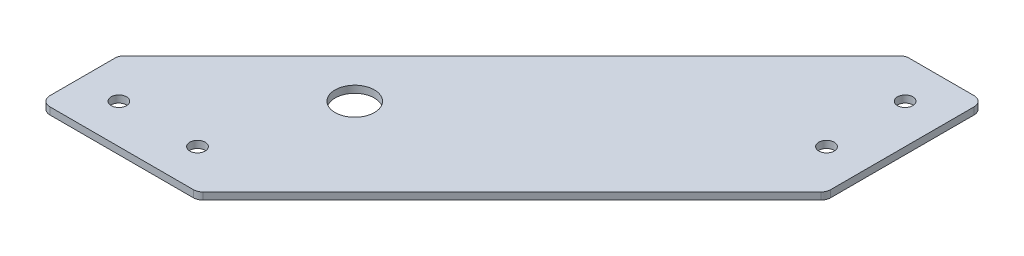
from build123d import *

# Parameters (mm, degrees)
SKETCH1_R           = 2.4892
SKETCH1_R_2         = 6.35
BOSS_EXTRUDE2_DEPTH = 1.143
CUT_EXTRUDE1_DEPTH  = 216.53826991
BOSS_EXTRUDE3_DEPTH = 2.286
FILLET3_R           = 3.175


with BuildPart() as part:
    # Sketch1 → Boss-Extrude2 (new, symmetric)
    with BuildSketch(Plane(origin=(0, 0, 0), x_dir=(1, 0, 0), z_dir=(0, 1, 0))):
        Polygon((0, 0), (0, 152.4), (-25.4, 152.4), (-152.4, 25.4), (-152.4, 0), align=None)
        with Locations(Location((-12.7, 12.7, 0), (0, 0, 270))):
            Circle(SKETCH1_R, mode=Mode.SUBTRACT)
        with Locations(Location((-38.1, 12.7, 0), (0, 0, 270))):
            Circle(SKETCH1_R, mode=Mode.SUBTRACT)
        with Locations(Location((-63.5, 12.7, 0), (0, 0, 270))):
            Circle(SKETCH1_R, mode=Mode.SUBTRACT)
        with Locations(Location((-88.9, 12.7, 0), (0, 0, 270))):
            Circle(SKETCH1_R, mode=Mode.SUBTRACT)
        with Locations(Location((-114.3, 12.7, 0), (0, 0, 270))):
            Circle(SKETCH1_R, mode=Mode.SUBTRACT)
        with Locations(Location((-12.7, 38.1, 0), (0, 0, 270))):
            Circle(SKETCH1_R, mode=Mode.SUBTRACT)
        with Locations(Location((-12.7, 63.5, 0), (0, 0, 270))):
            Circle(SKETCH1_R, mode=Mode.SUBTRACT)
        with Locations(Location((-12.7, 88.9, 0), (0, 0, 270))):
            Circle(SKETCH1_R, mode=Mode.SUBTRACT)
        with Locations(Location((-12.7, 114.3, 0), (0, 0, 270))):
            Circle(SKETCH1_R, mode=Mode.SUBTRACT)
        with Locations(Location((-139.7, 12.7, 0), (0, 0, 270))):
            Circle(SKETCH1_R, mode=Mode.SUBTRACT)
        with Locations(Location((-12.7, 139.7, 0), (0, 0, 270))):
            Circle(SKETCH1_R, mode=Mode.SUBTRACT)
        with Locations(Location((-101.6, 50.8, 0), (0, 0, 270))):
            Circle(SKETCH1_R_2, mode=Mode.SUBTRACT)
    extrude(amount=BOSS_EXTRUDE2_DEPTH, both=True)

    # Sketch2 → Cut-Extrude1 (cut, through all)
    with BuildSketch(Plane(origin=(0, 1.143, 0), x_dir=(1, 0, 0), z_dir=(0, 1, 0))):
        Polygon((0, 0), (0, 101.6), (-101.6, 0), align=None)
    extrude(amount=-CUT_EXTRUDE1_DEPTH, mode=Mode.SUBTRACT)

    # Sketch3 → Boss-Extrude3 (add)
    with BuildSketch(Plane(origin=(0, 1.143, 0), x_dir=(1, 0, 0), z_dir=(0, 1, 0))):
        Polygon((-101.6, 0), (-101.6, 15.120409187), (-15.612291765, 101.108117422), (0, 101.6), align=None)
    extrude(amount=-BOSS_EXTRUDE3_DEPTH)

    # Fillet3
    fillet3_edges = [part.edges().sort_by_distance(p)[0] for p in [
        (-101.6, 0, 0),
        (0, 0, -101.6),
        (-152.4, 0, 0),
        (-152.4, 0, -25.4),
        (-25.4, 0, -152.4),
        (0, 0, -152.4),
    ]]
    fillet(fillet3_edges, radius=FILLET3_R)


solid = part.part
